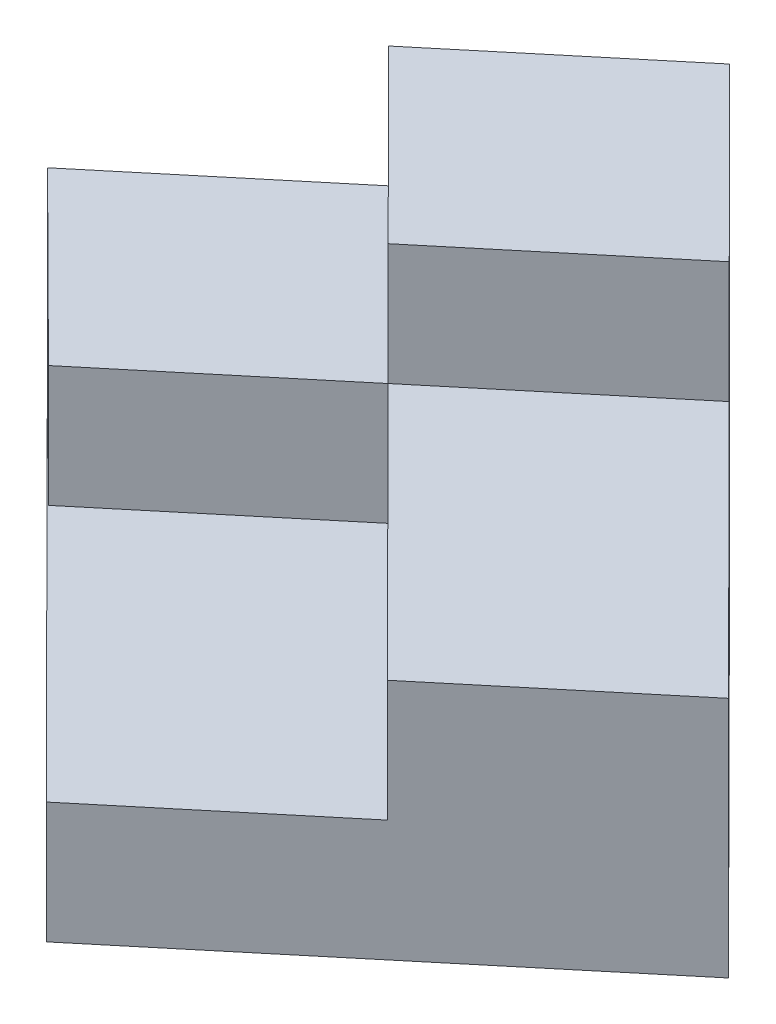
from build123d import *

# Parameters (mm, degrees)
BOSS_EXTRUDE1_DEPTH = 10
BOSS_EXTRUDE2_DEPTH = 10
BOSS_EXTRUDE3_DEPTH = 30
BOSS_EXTRUDE5_DEPTH = 20


with BuildPart() as part:
    # Sketch1 → Boss-Extrude1 (new body)
    with BuildSketch(Plane(origin=(0, 0, 0), x_dir=(1, 0, 0), z_dir=(0, 1, 0))):
        Polygon((0, 0), (35.302133222, -35.408464948), (4.552111931, -60.990415434), (-30.75002129, -25.581950485), align=None)
    extrude(amount=BOSS_EXTRUDE1_DEPTH)

    # Sketch2 → Boss-Extrude2 (add)
    with BuildSketch(Plane(origin=(0, 10, 0), x_dir=(1, 0, 0), z_dir=(0, 1, 0))):
        Polygon((-15.375010645, -12.790975243), (-30.75002129, -25.581950485), (-16.56947049, -39.685566298), (-1.259664797, -26.948837193), align=None)
    extrude(amount=BOSS_EXTRUDE2_DEPTH)

    # Sketch3 → Boss-Extrude3 (add)
    with BuildSketch(Plane(origin=(0, 0, 0), x_dir=(1, 0, 0), z_dir=(0, 1, 0))):
        Polygon((0, 0), (-15.375010645, -12.790975243), (-1.259664797, -26.948837193), (14.115345848, -14.15786195), align=None)
    extrude(amount=BOSS_EXTRUDE3_DEPTH)

    # Sketch4 → Boss-Extrude5 (add)
    with BuildSketch(Plane(origin=(0, 0, 0), x_dir=(1, 0, 0), z_dir=(0, 1, 0))):
        Polygon((14.115345848, -14.15786195), (-1.259664797, -26.948837193), (19.927122576, -48.199440191), (35.302133222, -35.408464948), align=None)
    extrude(amount=BOSS_EXTRUDE5_DEPTH)


solid = part.part
